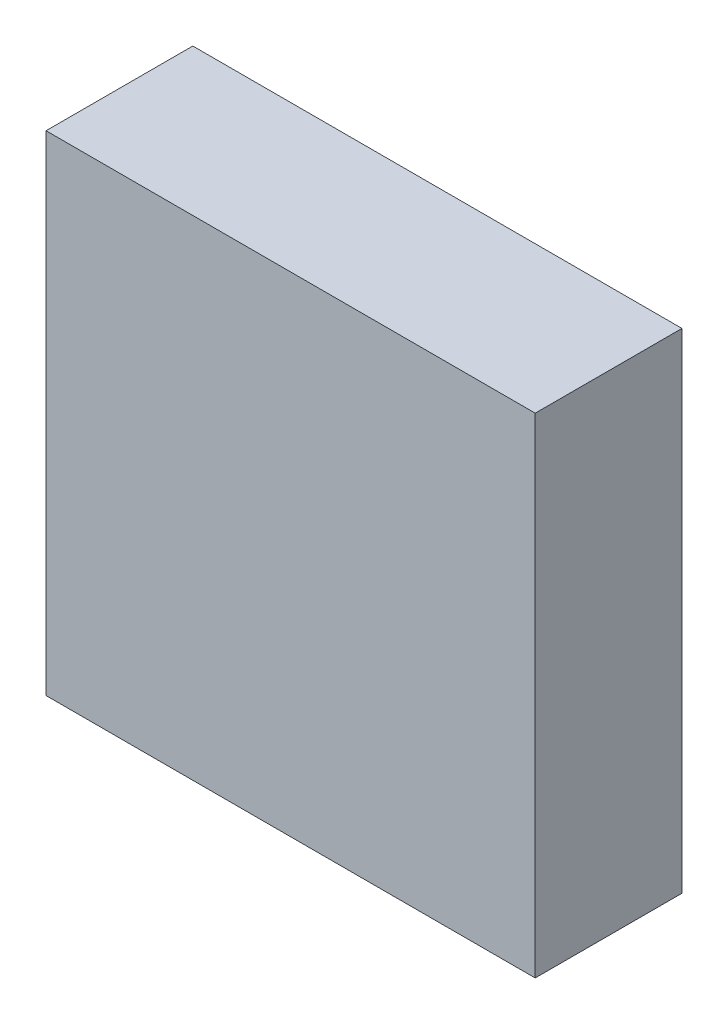
from build123d import *

# Parameters (mm, degrees)
SKETCH_1_W      = 40
SKETCH_1_H      = 40
EXTRUDE_1_DEPTH = 12


with BuildPart() as part:
    # 草图1 → 凸台-拉伸1 (new body)
    with BuildSketch(Plane.XY):
        with Locations((20, -20)):
            Rectangle(SKETCH_1_W, SKETCH_1_H)
    extrude(amount=EXTRUDE_1_DEPTH)


solid = part.part
